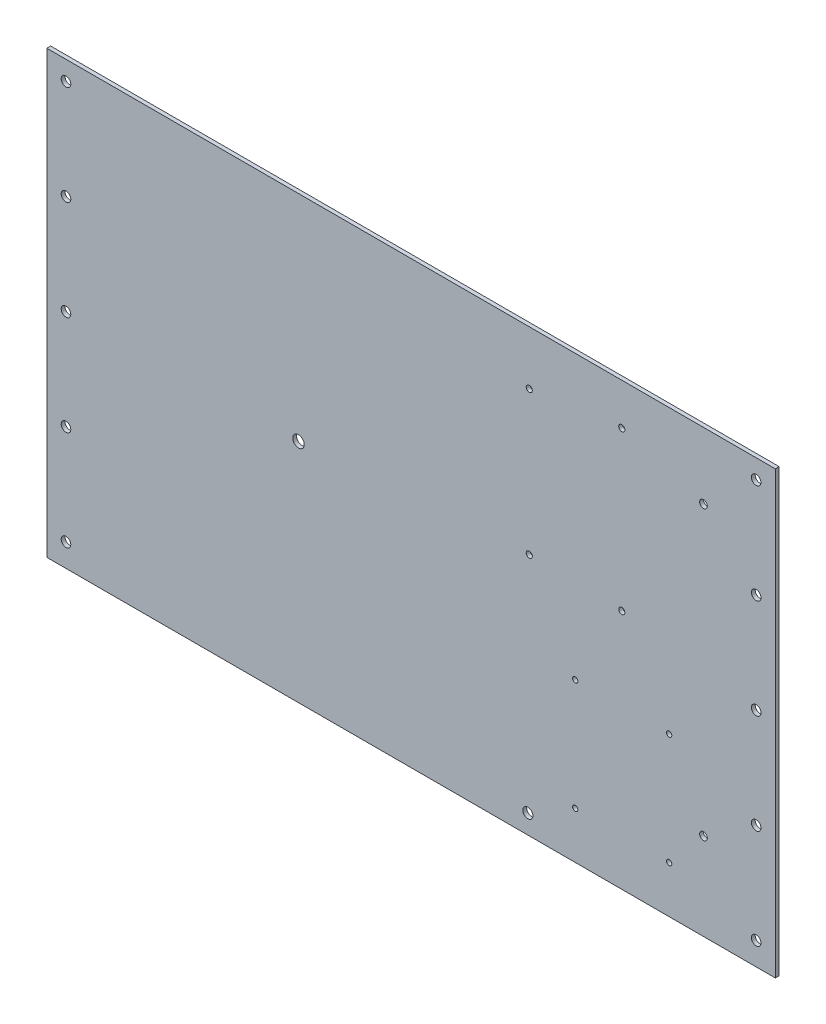
from build123d import *

# Parameters (mm, degrees)
SKICA2_W                 = 380
SKICA2_H                 = 230
P_IDAT_VYSUNUT_M1_DEPTH  = 2
SKICA3_R                 = 2.5
ODEBRAT_VYSUNUT_M1_DEPTH = 2
SKICA4_R                 = 1.604768665
SKICA4_R_2               = 1.589689297
SKICA4_R_3               = 1.5875
SKICA4_R_4               = 1.375
SKICA4_R_5               = 1.372501574
SKICA4_R_6               = 1.362238747
SKICA4_R_7               = 2
SKICA4_R_8               = 1.99507446
SKICA4_R_9               = 3
ODEBRAT_VYSUNUT_M2_DEPTH = 2
SKICA5_R                 = 2.6
ODEBRAT_VYSUNUT_M3_DEPTH = 2


with BuildPart() as part:
    # Skica2 → Přidat vysunutím1 (new body)
    with BuildSketch(Plane.XY):
        with Locations((-194.524287798, -195)):
            Rectangle(SKICA2_W, SKICA2_H)
    extrude(amount=P_IDAT_VYSUNUT_M1_DEPTH)

    # Skica3 → Odebrat vysunutím1 (cut)
    with BuildSketch(Plane.XY.offset(2)):
        with Locations((-374.524287798, -90)):
            Circle(SKICA3_R)
        with Locations((-374.524287798, -142)):
            Circle(SKICA3_R)
        with Locations((-374.524287798, -194)):
            Circle(SKICA3_R)
        with Locations((-374.524287798, -246)):
            Circle(SKICA3_R)
        with Locations((-374.524287798, -298)):
            Circle(SKICA3_R)
        with Locations((-14.524287798, -246)):
            Circle(SKICA3_R)
        with Locations((-14.524287798, -298)):
            Circle(SKICA3_R)
        with Locations((-14.524287798, -194)):
            Circle(SKICA3_R)
        with Locations((-14.524287798, -142)):
            Circle(SKICA3_R)
        with Locations((-14.524287798, -90)):
            Circle(SKICA3_R)
    extrude(amount=-ODEBRAT_VYSUNUT_M1_DEPTH, mode=Mode.SUBTRACT)

    # Skica4 → Odebrat vysunutím2 (cut)
    with BuildSketch(Plane.XY.offset(2)):
        with Locations((-84.619074008, -101.667480714)):
            Circle(SKICA4_R)
        with Locations((-132.879074008, -108.017480714)):
            Circle(SKICA4_R_2)
        with Locations((-132.879074008, -182.947480714)):
            Circle(SKICA4_R_3)
        with Locations((-84.619074008, -184.217480714)):
            Circle(SKICA4_R_3)
        with Locations((-108.908932218, -227.518390056)):
            Circle(SKICA4_R_4)
        with Locations((-59.908932218, -227.518390056)):
            Circle(SKICA4_R_4)
        with Locations((-59.908932218, -285.518390056)):
            Circle(SKICA4_R_5)
        with Locations((-108.908932218, -285.518390056)):
            Circle(SKICA4_R_6)
        with Locations((-42.024287798, -264.637326757)):
            Circle(SKICA4_R_7)
        with Locations((-42.024287798, -114.637326757)):
            Circle(SKICA4_R_8)
        with Locations((-253.250828503, -191.950902839)):
            Circle(SKICA4_R_9)
    extrude(amount=-ODEBRAT_VYSUNUT_M2_DEPTH, mode=Mode.SUBTRACT)

    # Skica5 → Odebrat vysunutím3 (cut)
    with BuildSketch(Plane.XY.offset(2)):
        with Locations((-133.614229541, -300)):
            Circle(SKICA5_R)
    extrude(amount=-ODEBRAT_VYSUNUT_M3_DEPTH, mode=Mode.SUBTRACT)


solid = part.part
